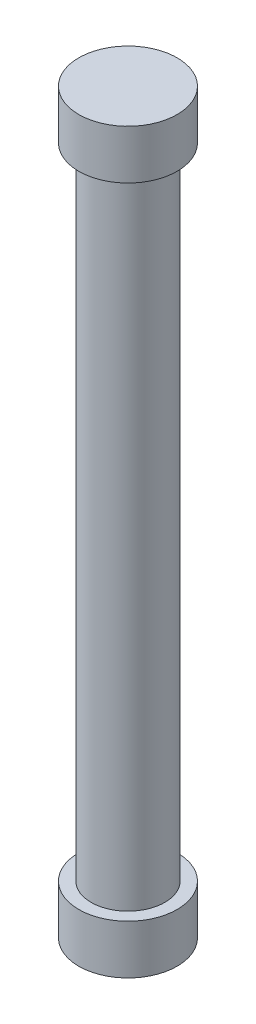
from build123d import *


with BuildPart() as part:
    # Sketch1 → Revolve1 (revolve)
    with BuildSketch(Plane.XY, mode=Mode.PRIVATE) as revolve1_sk:
        Polygon((0, 15), (0, -15), (-2, -15), (-2, -13), (-1.5, -13), (-1.5, 13), (-2, 13), (-2, 15), align=None)
    revolve(revolve1_sk.sketch.rotate(Axis((0, 15, 0), (0, -1, 0)), 270), axis=Axis((0, 15, 0), (0, -1, 0)))


solid = part.part
